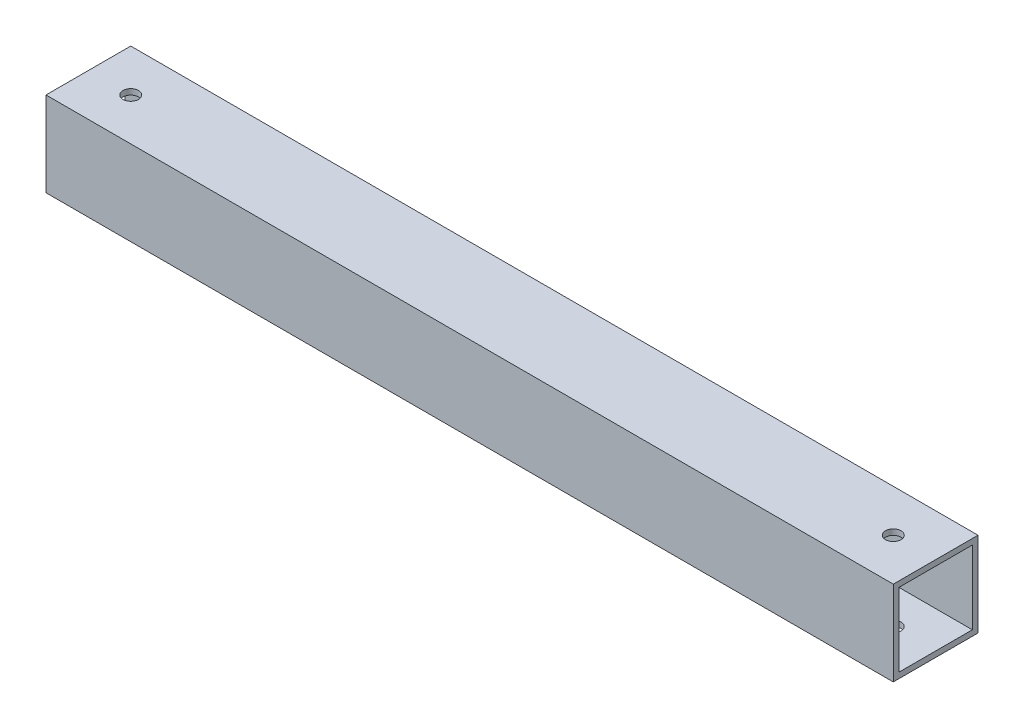
from build123d import *

# Parameters (mm, degrees)
SKETCH1_W           = 30
SKETCH1_H           = 30
SKETCH1_W_2         = 26
SKETCH1_H_2         = 26
BOSS_EXTRUDE1_DEPTH = 150
SKETCH2_R           = 2.75
CUT_EXTRUDE1_DEPTH  = 152.492574075


with BuildPart() as part:
    # Sketch1 → Boss-Extrude1 (new, symmetric)
    with BuildSketch(Plane(origin=(0, 0, 0), x_dir=(0, 0, -1), z_dir=(1, 0, 0))):
        Rectangle(SKETCH1_W, SKETCH1_H)
        Rectangle(SKETCH1_W_2, SKETCH1_H_2, mode=Mode.SUBTRACT)
    extrude(amount=BOSS_EXTRUDE1_DEPTH, both=True)

    # Sketch2 → Cut-Extrude1 (cut, symmetric)
    with BuildSketch(Plane(origin=(0, 0, 0), x_dir=(1, 0, 0), z_dir=(0, 1, 0))):
        with Locations(Location((135, 0, 0), (0, 0, 270))):
            Circle(SKETCH2_R)
    cut_extrude1 = extrude(amount=CUT_EXTRUDE1_DEPTH, both=True, mode=Mode.SUBTRACT)

    # Mirror1: Cut-Extrude1 across plane
    add(cut_extrude1.mirror(Plane(origin=(0, 0, 0), x_dir=(0, 0, 1), z_dir=(1, 0, 0))), mode=Mode.SUBTRACT)


solid = part.part
